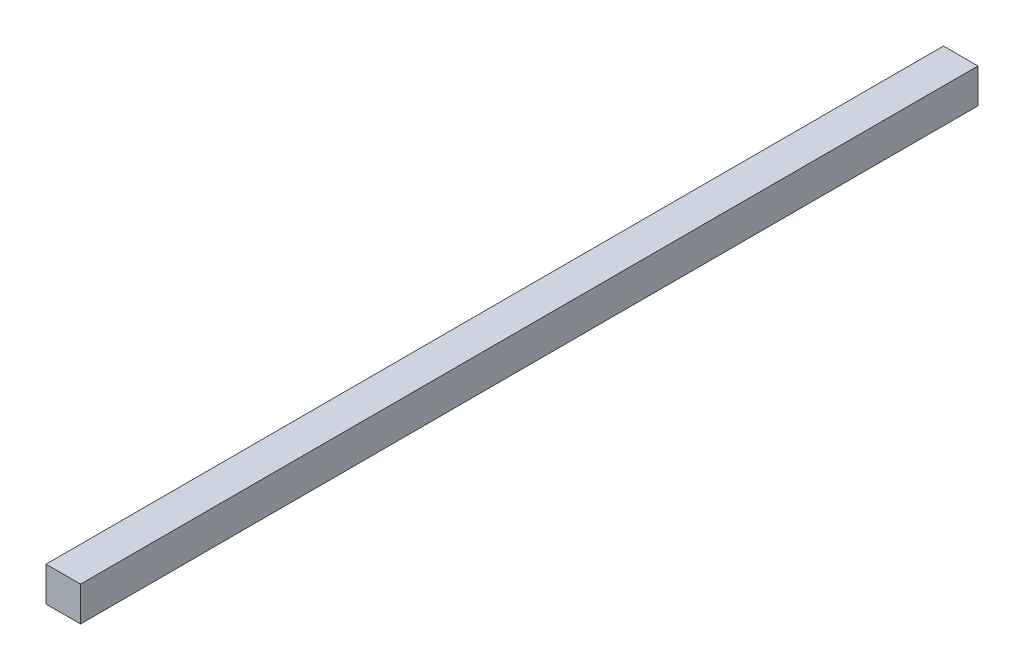
from build123d import *

# Parameters (mm, degrees)
SKETCH1_W           = 25.4
SKETCH1_H           = 660.4
BOSS_EXTRUDE1_DEPTH = 25.4


with BuildPart() as part:
    # Sketch1 → Boss-Extrude1 (new body)
    with BuildSketch(Plane(origin=(0, 0, 0), x_dir=(1, 0, 0), z_dir=(0, 1, 0))):
        with Locations((12.7, 330.2)):
            Rectangle(SKETCH1_W, SKETCH1_H)
    extrude(amount=BOSS_EXTRUDE1_DEPTH)


solid = part.part
